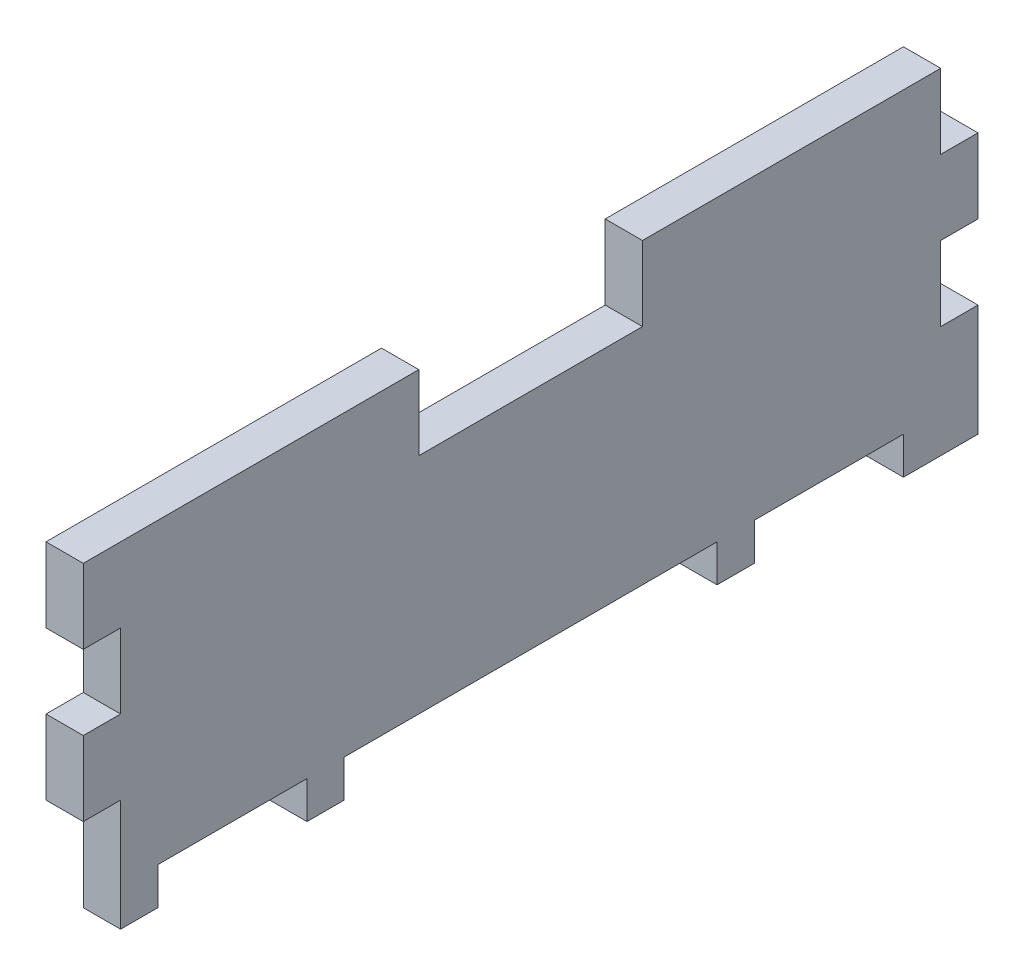
from build123d import *

# Parameters (mm, degrees)
BOSS_EXTRUDE1_DEPTH = 6.35
SKETCH1_4_W         = 6.35
SKETCH1_4_H         = 6.35
BOSS_EXTRUDE2_DEPTH = 6.35


with BuildPart() as part:
    # Sketch1 → Boss-Extrude1 (new body)
    with BuildSketch(Plane(origin=(0, 0, 0), x_dir=(0, 0, -1), z_dir=(1, 0, 0))):
        Polygon((-76.2, 25.4), (-76.2, 12.7), (-69.85, 12.7), (-69.85, 0), (-76.2, 0), (-76.2, -12.7), (-69.85, -12.7), (-69.85, -31.75), (-63.5, -31.75), (-63.5, -25.4), (-38.1, -25.4), (-38.1, -31.75), (-31.75, -31.75), (-31.75, -25.4), (31.75, -25.4), (31.75, -31.75), (38.1, -31.75), (38.1, -25.4), (63.5, -25.4), (63.5, -31.75), (69.85, -31.75), (69.85, -25.4), (76.2, -25.4), (76.2, -12.7), (69.85, -12.7), (69.85, 0), (76.2, 0), (76.2, 12.7), (69.85, 12.7), (69.85, 25.4), (19.05, 25.4), (19.05, 12.7), (-19.05, 12.7), (-19.05, 25.4), align=None)
    extrude(amount=BOSS_EXTRUDE1_DEPTH)

    # Sketch1<4> → Boss-Extrude2 (add)
    with BuildSketch(Plane(origin=(0, 0, 0), x_dir=(0, 0, -1), z_dir=(1, 0, 0))):
        with Locations((73.025, -28.575)):
            Rectangle(SKETCH1_4_W, SKETCH1_4_H)
    extrude(amount=BOSS_EXTRUDE2_DEPTH)


solid = part.part
